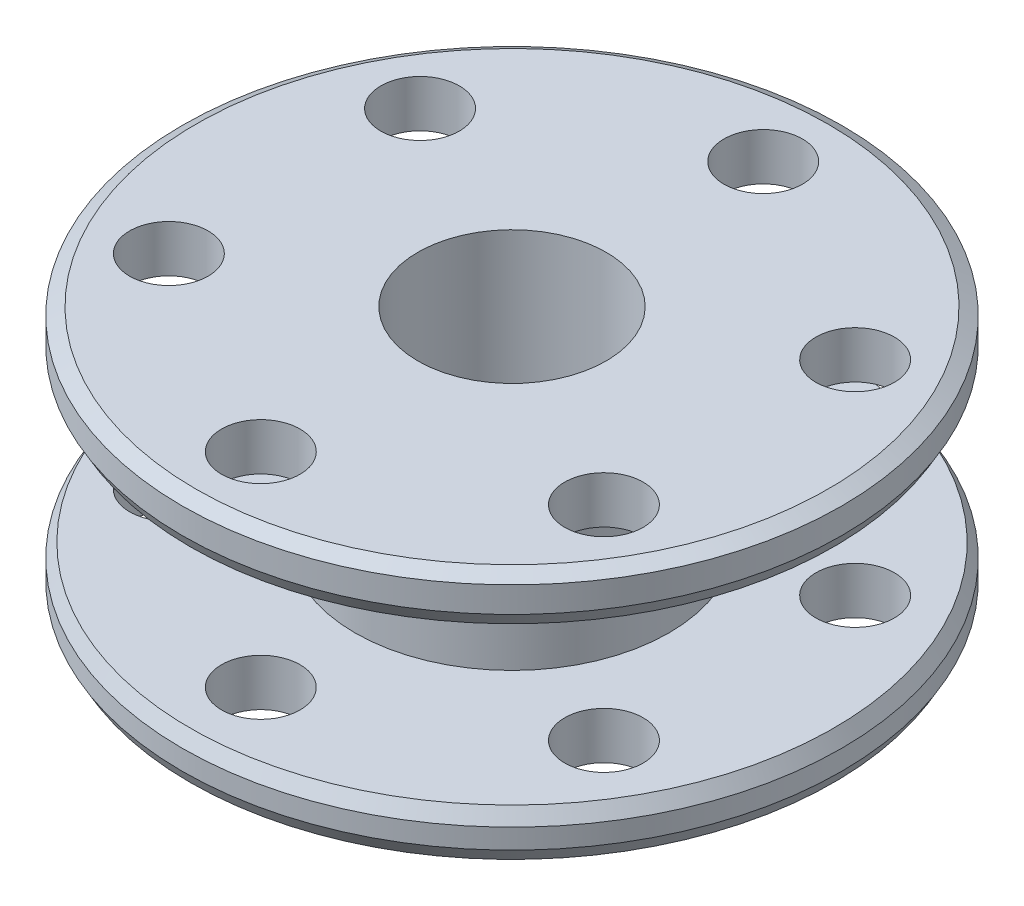
from build123d import *
from OCP.BRepFilletAPI import BRepFilletAPI_MakeChamfer

# Parameters (mm, degrees)
SKETCH1_R           = 21
SKETCH1_R_2         = 6
SKETCH1_R_3         = 2.5
BOSS_EXTRUDE1_DEPTH = 16
SKETCH2_W           = 22.451469184
SKETCH2_H           = 10
CHAMFER1_SIZE       = 0.5
CHAMFER1_SIZE2      = 0.866025404


with BuildPart() as part:
    # Sketch1 → Boss-Extrude1 (new body)
    with BuildSketch(Plane(origin=(0, 0, 0), x_dir=(1, 0, 0), z_dir=(0, 1, 0))):
        with Locations(Location((0, 0, 0), (0, 0, 270))):
            Circle(SKETCH1_R)
        with Locations(Location((0, 0, 0), (0, 0, 270))):
            Circle(SKETCH1_R_2, mode=Mode.SUBTRACT)
        with Locations(Location((0, 16, 0), (0, 0, 270))):
            Circle(SKETCH1_R_3, mode=Mode.SUBTRACT)
        with Locations(Location((13.856406461, 8, 0), (0, 0, 270))):
            Circle(SKETCH1_R_3, mode=Mode.SUBTRACT)
        with Locations(Location((13.856406461, -8, 0), (0, 0, 270))):
            Circle(SKETCH1_R_3, mode=Mode.SUBTRACT)
        with Locations(Location((0, -16, 0), (0, 0, 270))):
            Circle(SKETCH1_R_3, mode=Mode.SUBTRACT)
        with Locations(Location((-13.856406461, -8, 0), (0, 0, 270))):
            Circle(SKETCH1_R_3, mode=Mode.SUBTRACT)
        with Locations(Location((-13.856406461, 8, 0), (0, 0, 270))):
            Circle(SKETCH1_R_3, mode=Mode.SUBTRACT)
    extrude(amount=BOSS_EXTRUDE1_DEPTH)

    # Sketch2 → Cut-Revolve1 (revolve, cut)
    with BuildSketch(Plane(origin=(0, 0, 0), x_dir=(0, 0, -1), z_dir=(1, 0, 0))):
        with Locations((21.225734592, 8)):
            Rectangle(SKETCH2_W, SKETCH2_H)
    revolve(axis=Axis((0, 0, 0), (0, 1, 0)), mode=Mode.SUBTRACT)

    # Chamfer1: one chamfer whose edges measure the first distance from different faces: ONE call of the kernel's chamfer builder (chamfer() names one face for all edges)
    chamfer1_edges_1 = [part.edges().sort_by_distance(p)[0] for p in [
        (0, 0, -21),
    ]]
    chamfer1_side_1 = [part.faces().sort_by_distance(p)[0] for p in [
        (0, 0, -20.406030304),
    ]]
    chamfer1_edges_2 = [part.edges().sort_by_distance(p)[0] for p in [
        (0, 3, -21),
    ]]
    chamfer1_side_2 = [part.faces().sort_by_distance(p)[0] for p in [
        (0, 3, -20.406030304),
    ]]
    chamfer1_edges_3 = [part.edges().sort_by_distance(p)[0] for p in [
        (0, 13, -21),
    ]]
    chamfer1_side_3 = [part.faces().sort_by_distance(p)[0] for p in [
        (0, 13, -20.406030304),
    ]]
    chamfer1_edges_4 = [part.edges().sort_by_distance(p)[0] for p in [
        (0, 16, -21),
    ]]
    chamfer1_side_4 = [part.faces().sort_by_distance(p)[0] for p in [
        (0, 14.5, -21),
    ]]
    chamfer1 = BRepFilletAPI_MakeChamfer(part.part.solid().wrapped)
    for e in chamfer1_edges_1:
        chamfer1.Add(CHAMFER1_SIZE, CHAMFER1_SIZE2, e.wrapped, chamfer1_side_1[0].wrapped)  # the first distance lies on this face
    for e in chamfer1_edges_2:
        chamfer1.Add(CHAMFER1_SIZE, CHAMFER1_SIZE2, e.wrapped, chamfer1_side_2[0].wrapped)  # the first distance lies on this face
    for e in chamfer1_edges_3:
        chamfer1.Add(CHAMFER1_SIZE, CHAMFER1_SIZE2, e.wrapped, chamfer1_side_3[0].wrapped)  # the first distance lies on this face
    for e in chamfer1_edges_4:
        chamfer1.Add(CHAMFER1_SIZE, CHAMFER1_SIZE2, e.wrapped, chamfer1_side_4[0].wrapped)  # the first distance lies on this face
    add(Compound.cast(chamfer1.Shape()), mode=Mode.REPLACE)


solid = part.part
